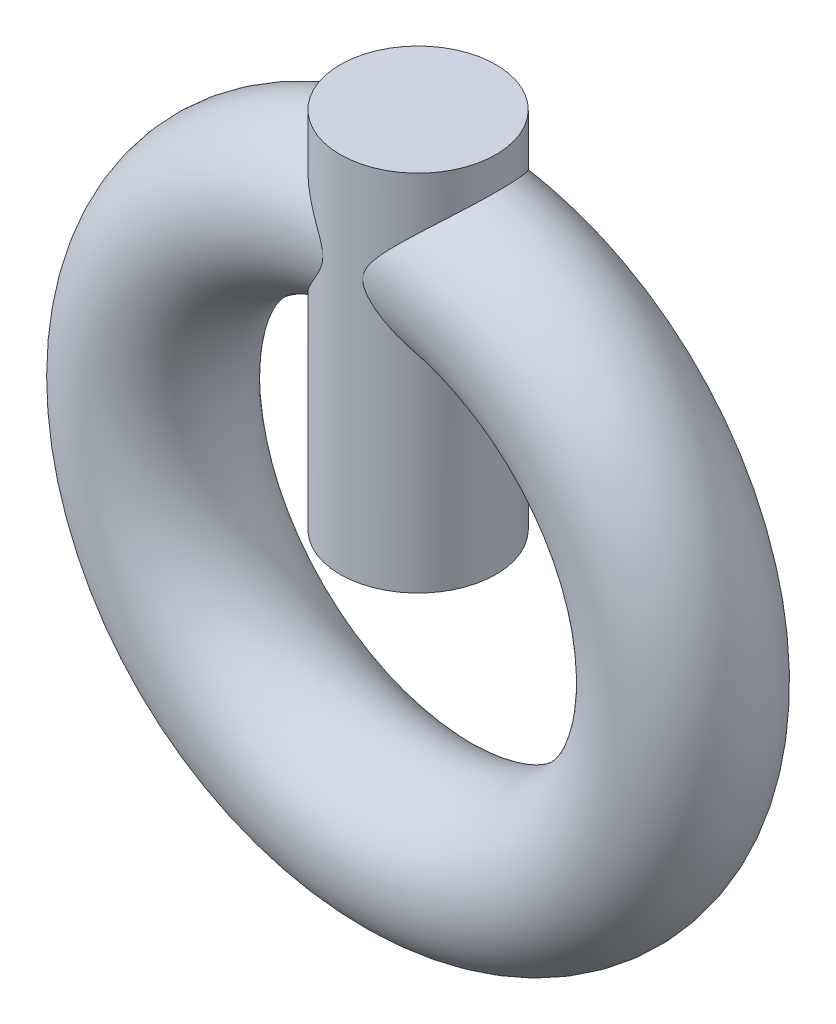
from build123d import *

# Parameters (mm, degrees)
SKETCH_3_R      = 1.45
SKETCH_6_R      = 1.5
EXTRUDE_1_DEPTH = 7


with BuildPart() as part:
    # 扫描1: sweep along a path in 草图1
    with BuildLine(Plane.XY) as sweep_1_path:
        CenterArc((0, 0), 5, 0, 360)
    # 草图3 → 扫描1 (sweep)
    with BuildSketch(Plane(origin=(0, 0, 0), x_dir=(0, 0, -1), z_dir=(1, 0, 0))):
        with Locations((0, 5.1)):
            Circle(SKETCH_3_R)
    sweep(path=sweep_1_path.line)

    # 草图6 → 凸台-拉伸1 (add)
    with BuildSketch(Plane(origin=(0, 0, 0), x_dir=(1, 0, 0), z_dir=(0, 1, 0))):
        with Locations(Location((0, 0, 0), (0, 0, 270))):
            Circle(SKETCH_6_R)
    extrude(amount=EXTRUDE_1_DEPTH)


solid = part.part
